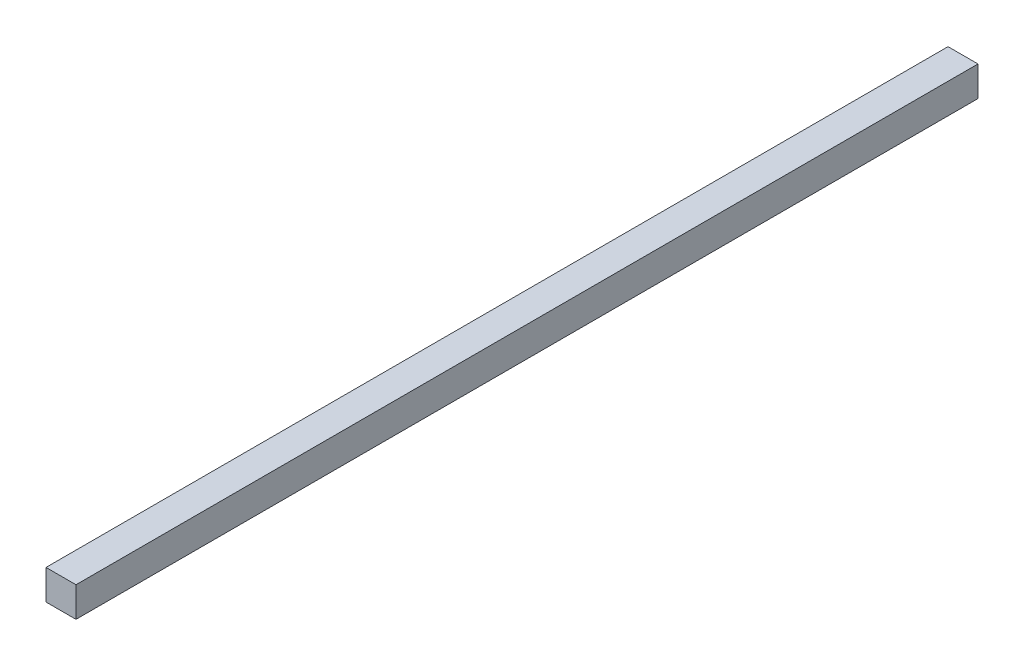
from build123d import *

# Parameters (mm, degrees)
ESQUISSE1_W        = 10
ESQUISSE1_H        = 10
BOSS_EXTRU_1_DEPTH = 300.81


with BuildPart() as part:
    # Esquisse1 → Boss.-Extru.1 (new body)
    with BuildSketch(Plane.XY):
        with Locations((5, 5)):
            Rectangle(ESQUISSE1_W, ESQUISSE1_H)
    extrude(amount=BOSS_EXTRU_1_DEPTH)


solid = part.part
